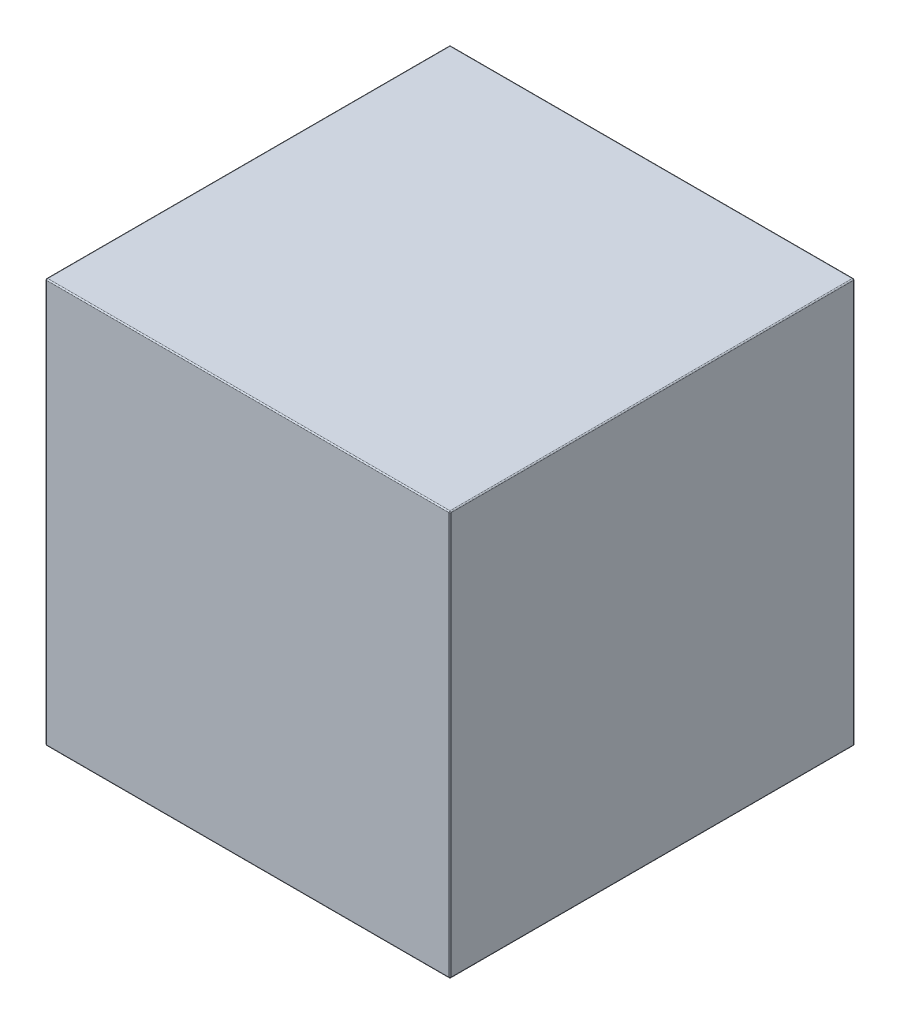
from build123d import *

# Parameters (mm, degrees)
SKETCH1_W           = 350
SKETCH1_H           = 350
BOSS_EXTRUDE1_DEPTH = 175
FILLET1_R           = 1


with BuildPart() as part:
    # Sketch1 → Boss-Extrude1 (new, symmetric)
    with BuildSketch(Plane(origin=(0, 0, 0), x_dir=(1, 0, 0), z_dir=(0, 1, 0))):
        Rectangle(SKETCH1_W, SKETCH1_H)
    extrude(amount=BOSS_EXTRUDE1_DEPTH, both=True)

    # Fillet1
    fillet1_edges = [part.edges().sort_by_distance(p)[0] for p in [
        (-175, 175, 0),
        (0, 175, 175),
        (175, 175, 0),
        (0, -175, 175),
        (-175, -175, 0),
        (175, -175, 0),
        (175, 0, 175),
        (-175, 0, 175),
        (-175, 0, -175),
        (175, 0, -175),
        (0, 175, -175),
    ]]
    fillet(fillet1_edges, radius=FILLET1_R)


solid = part.part
